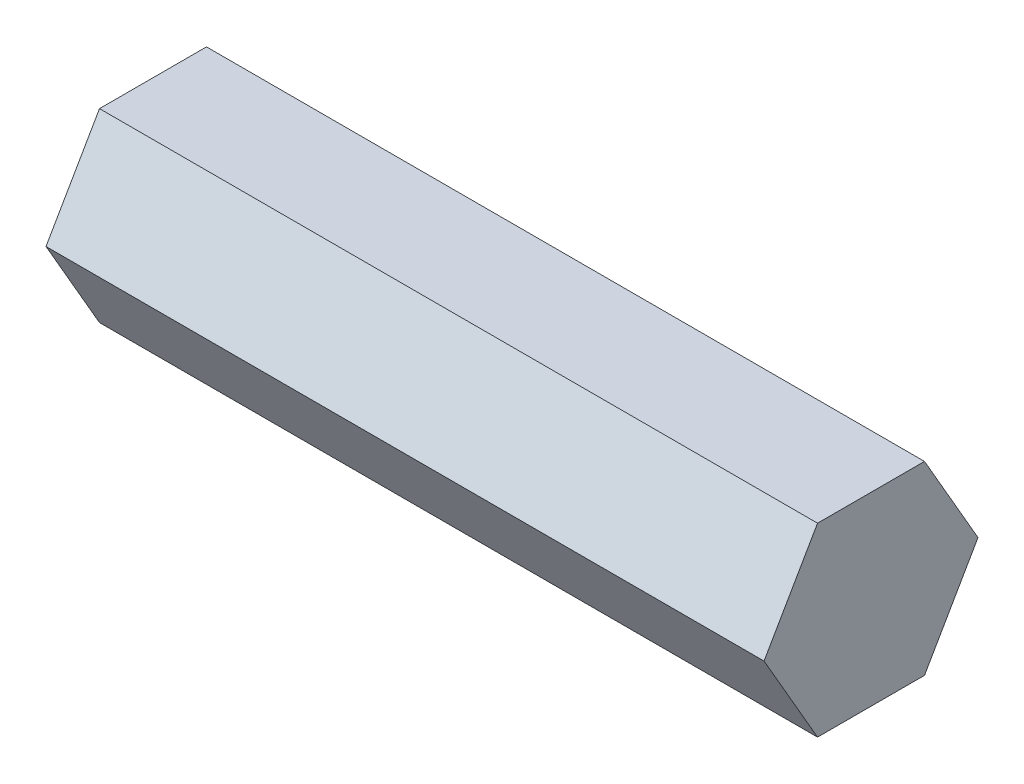
from build123d import *

# Parameters (mm, degrees)
BOSS_EXTRUDE1_DEPTH = 49.2125


with BuildPart() as part:
    # Sketch1 → Boss-Extrude1 (new body)
    with BuildSketch(Plane(origin=(0, 0, 0), x_dir=(0, 0, -1), z_dir=(1, 0, 0))):
        Polygon((7.332348419, 0), (3.666174209, 6.35), (-3.666174209, 6.35), (-7.332348419, 0), (-3.666174209, -6.35), (3.666174209, -6.35), align=None)
    extrude(amount=BOSS_EXTRUDE1_DEPTH)


solid = part.part
